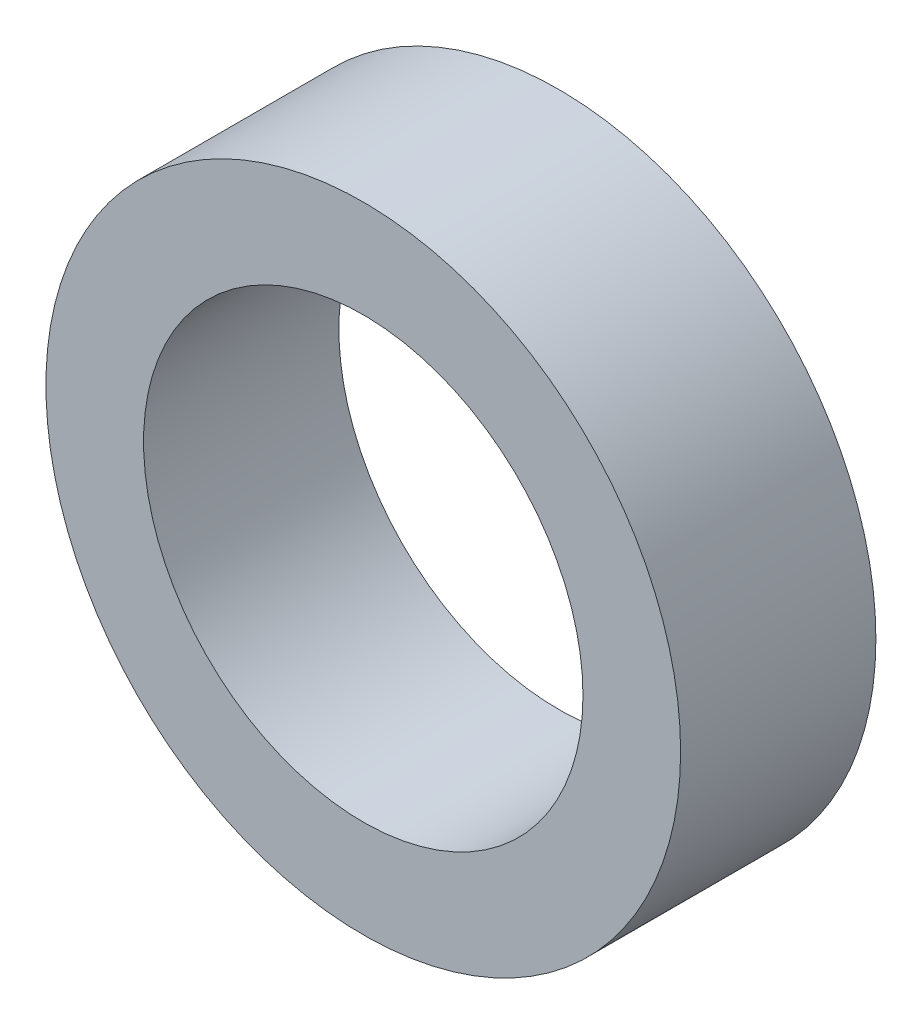
from build123d import *

# Parameters (mm, degrees)
SKETCH1_R           = 6.5
SKETCH1_R_2         = 4.5
BOSS_EXTRUDE1_DEPTH = 4


with BuildPart() as part:
    # Sketch1 → Boss-Extrude1 (new body)
    with BuildSketch(Plane.XY):
        Circle(SKETCH1_R)
        Circle(SKETCH1_R_2, mode=Mode.SUBTRACT)
    extrude(amount=BOSS_EXTRUDE1_DEPTH)


solid = part.part
